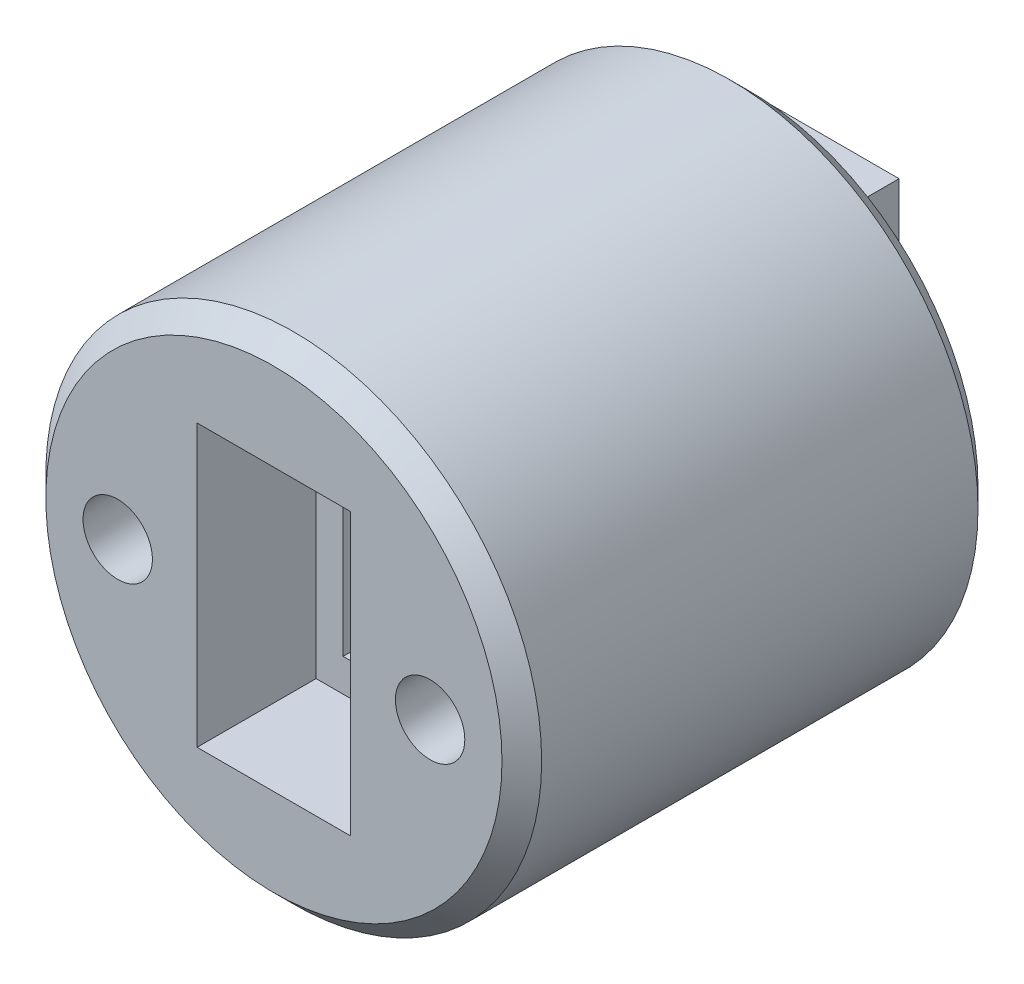
from build123d import *

# Parameters (mm, degrees)
CROQUIS1_R              = 12.5
SALIENTE_EXTRUIR1_DEPTH = 24
CROQUIS2_W              = 7.746059902
CROQUIS2_H              = 14.16230267
CORTAR_EXTRUIR1_DEPTH   = 6
CROQUIS3_W              = 7.04155471
CROQUIS3_H              = 14.887858528
SALIENTE_EXTRUIR2_DEPTH = 5
CHAFL_N1_SIZE           = 1
CHAFL_N2_SIZE           = 1
CROQUIS4_R              = 1.75
CORTAR_EXTRUIR2_DEPTH   = 34.963215395
CHAFL_N3_SIZE           = 1
CROQUIS5_W              = 5.029681936
CROQUIS5_H              = 10.86411298
CORTAR_EXTRUIR3_DEPTH   = 30.008619409


with BuildPart() as part:
    # Croquis1 → Saliente-Extruir1 (new body)
    with BuildSketch(Plane.XY):
        Circle(CROQUIS1_R)
    extrude(amount=SALIENTE_EXTRUIR1_DEPTH)

    # Croquis2 → Cortar-Extruir1 (cut)
    with BuildSketch(Plane.XY.offset(24)):
        Rectangle(CROQUIS2_W, CROQUIS2_H)
    extrude(amount=-CORTAR_EXTRUIR1_DEPTH, mode=Mode.SUBTRACT)

    # Croquis3 → Saliente-Extruir2 (add)
    with BuildSketch(Plane(origin=(0, 0, 0), x_dir=(-1, 0, 0), z_dir=(0, 0, -1))):
        Rectangle(CROQUIS3_W, CROQUIS3_H)
    extrude(amount=SALIENTE_EXTRUIR2_DEPTH)

    # Chaflán1
    chafl_n1_edges = [part.edges().sort_by_distance(p)[0] for p in [
        (-3.520777355, 0, -5),
        (0, 7.443929264, -5),
        (3.520777355, 0, -5),
        (0, -7.443929264, -5),
    ]]
    chamfer(chafl_n1_edges, length=CHAFL_N1_SIZE)

    # Chaflán2
    chafl_n2_edges = [part.edges().sort_by_distance(p)[0] for p in [
        (-12.5, 0, 0),
    ]]
    chamfer(chafl_n2_edges, length=CHAFL_N2_SIZE)

    # Croquis4 → Cortar-Extruir2 (cut, through all)
    with BuildSketch(Plane.XY.offset(24)):
        with Locations((-7.875, 0)):
            Circle(CROQUIS4_R)
        with Locations((7.875, 0)):
            Circle(CROQUIS4_R)
    extrude(amount=-CORTAR_EXTRUIR2_DEPTH, mode=Mode.SUBTRACT)

    # Chaflán3
    chafl_n3_edges = [part.edges().sort_by_distance(p)[0] for p in [
        (-12.5, 0, 24),
    ]]
    chamfer(chafl_n3_edges, length=CHAFL_N3_SIZE)

    # Croquis5 → Cortar-Extruir3 (cut, through all)
    with BuildSketch(Plane.XY.offset(18)):
        Rectangle(CROQUIS5_W, CROQUIS5_H)
    extrude(amount=-CORTAR_EXTRUIR3_DEPTH, mode=Mode.SUBTRACT)


solid = part.part
